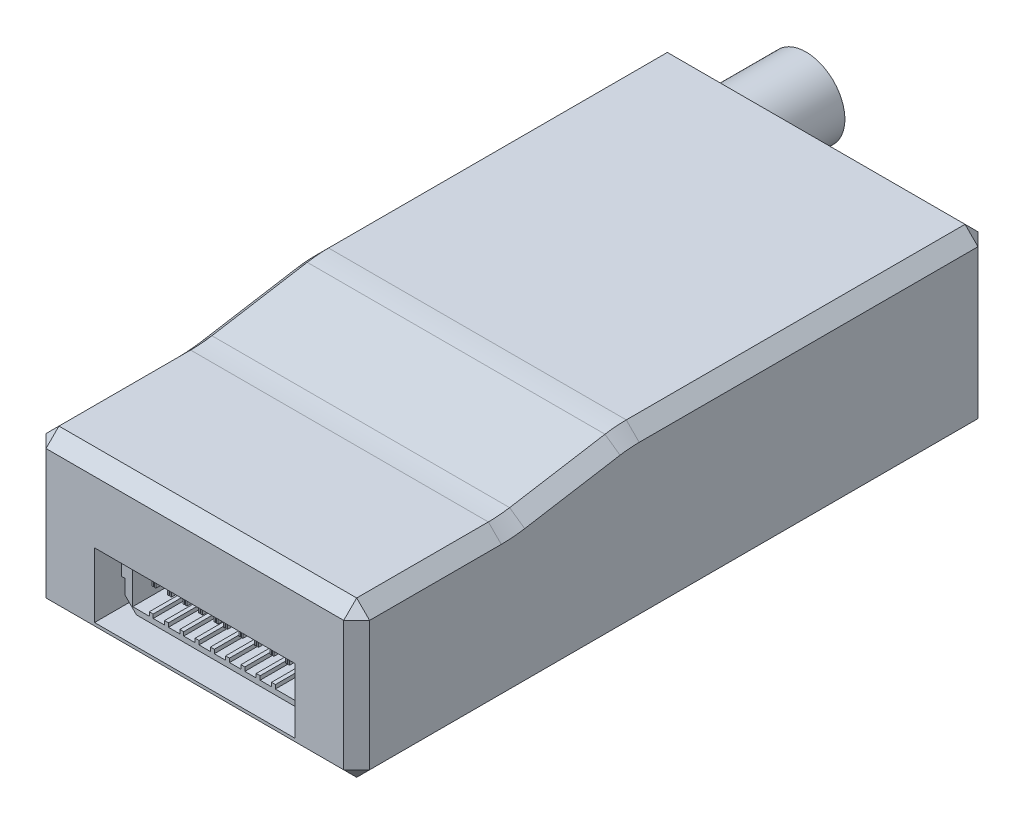
from build123d import *

# Parameters (mm, degrees)
BOSS_EXTRUDE1_DEPTH = 25
CHAMFER1_SIZE       = 1
SKETCH4_W           = 15.5
SKETCH4_H           = 5
CUT_EXTRUDE1_DEPTH  = 10
SKETCH5_W           = 1
SKETCH5_H           = 0.55
BOSS_EXTRUDE2_DEPTH = 8
CUT_EXTRUDE2_DEPTH  = 10
SKETCH7_W           = 0.3
SKETCH7_H           = 0.3
BOSS_EXTRUDE3_DEPTH = 10
SKETCH8_R           = 3
SKETCH8_R_2         = 2.5
BOSS_EXTRUDE4_DEPTH = 6


with BuildPart() as part:
    # Sketch3 → Boss-Extrude1 (new body)
    with BuildSketch(Plane(origin=(0, 0, 0), x_dir=(0, 0, -1), z_dir=(1, 0, 0))):
        with BuildLine():
            Line((0, 0), (-49, 0))
            Line((-49, 0), (-49, 12))
            Line((-49, 12), (-37.827625303, 12))
            ThreePointArc((-37.827625303, 12), (-37.002819988, 12.03407324), (-36.18363543, 12.136060762))
            Line((-36.18363543, 12.136060762), (-28.81636457, 13.363939238))
            ThreePointArc((-28.81636457, 13.363939238), (-27.997180012, 13.46592676), (-27.172374697, 13.5))
            Line((-27.172374697, 13.5), (0, 13.5))
            Line((0, 13.5), (0, 0))
        make_face()
    extrude(amount=BOSS_EXTRUDE1_DEPTH)

    # Chamfer1
    chamfer1_edges = [part.edges().sort_by_distance(p)[0] for p in [
        (0, 12.75, 32.5),
        (0, 13.46592676, 27.997180012),
        (0, 13.5, 13.586187349),
        (0, 6.75, 0),
        (25, 13.46592676, 27.997180012),
        (12.5, 0, 0),
        (12.5, 0, 49),
        (12.5, 12, 49),
        (12.5, 13.5, 0),
        (25, 12.75, 32.5),
        (25, 12.03407324, 37.002819988),
        (25, 12, 43.413812651),
        (25, 6, 49),
        (25, 0, 24.5),
        (25, 6.75, 0),
        (0, 0, 24.5),
        (25, 13.5, 13.586187349),
        (0, 6, 49),
        (0, 12, 43.413812651),
        (0, 12.03407324, 37.002819988),
    ]]
    chamfer(chamfer1_edges, length=CHAMFER1_SIZE)

    # Sketch4 → Cut-Extrude1 (cut)
    with BuildSketch(Plane.XY.offset(49)):
        with Locations((12.5, 3.731572294)):
            Rectangle(SKETCH4_W, SKETCH4_H)
    extrude(amount=-CUT_EXTRUDE1_DEPTH, mode=Mode.SUBTRACT)

    # Sketch5 → Boss-Extrude2 (add)
    with BuildSketch(Plane.XY.offset(39)):
        Polygon((20.186366737, 6.162059048), (4.813633263, 6.162059048), (4.813633263, 3.362059048), (5.1, 3.362059048), (5.1, 2.250733439), (5.988674392, 1.362059048), (19.011325608, 1.362059048), (19.9, 2.250733439), (19.9, 3.362059048), (20.186366737, 3.362059048), align=None)
        Polygon((8.1, 6.062059048), (16.9, 6.062059048), (16.9, 4.562059048), (15.516884386, 4.562059048), (15.030478648, 4.762059048), (9.969521352, 4.762059048), (9.483115614, 4.562059048), (8.1, 4.562059048), align=None, mode=Mode.SUBTRACT)
        with Locations((17.75, 5.405243542)):
            Rectangle(SKETCH5_W, SKETCH5_H, mode=Mode.SUBTRACT)
        with Locations((19.15, 5.399458355)):
            Rectangle(SKETCH5_W, SKETCH5_H, mode=Mode.SUBTRACT)
        with Locations((5.85, 5.399458355)):
            Rectangle(SKETCH5_W, SKETCH5_H, mode=Mode.SUBTRACT)
        with Locations((7.25, 5.405243542)):
            Rectangle(SKETCH5_W, SKETCH5_H, mode=Mode.SUBTRACT)
    extrude(amount=BOSS_EXTRUDE2_DEPTH)

    # Sketch6 → Cut-Extrude2 (cut)
    with BuildSketch(Plane.XY.offset(47)):
        Polygon((12.29, 4.267126877), (12.71, 4.267126877), (12.71, 3.897126877), (12.81, 3.897126877), (12.81, 4.267126877), (12.91, 4.267126877), (12.91, 3.897644042), (13.01, 3.897644042), (13.01, 4.267126877), (13.91, 4.267126877), (13.91, 3.897126877), (14.01, 3.897126877), (14.01, 4.267126877), (14.11, 4.267126877), (14.11, 3.897644042), (14.21, 3.897644042), (14.21, 4.267126877), (15.11, 4.267126877), (15.11, 3.897126877), (15.21, 3.897126877), (15.21, 4.267126877), (15.31, 4.267126877), (15.31, 3.897644042), (15.41, 3.897644042), (15.41, 4.267126877), (16.31, 4.267126877), (16.31, 3.897126877), (16.41, 3.897126877), (16.41, 4.267126877), (16.51, 4.267126877), (16.51, 3.897644042), (16.61, 3.897644042), (16.61, 4.267126877), (17.51, 4.267126877), (17.51, 3.897126877), (17.61, 3.897126877), (17.61, 4.267126877), (17.71, 4.267126877), (17.71, 3.897644042), (17.81, 3.897644042), (17.81, 4.267126877), (18.18, 4.267126877), (18.18, 4.477126877), (18.4, 4.477126877), (18.4, 4.267126877), (18.9, 4.267126877), (18.9, 4.767126877), (19.3, 4.767126877), (19.3, 1.767126877), (5.7, 1.767126877), (5.7, 4.767126877), (6.1, 4.767126877), (6.1, 4.267126877), (6.6, 4.267126877), (6.6, 4.477126877), (6.82, 4.477126877), (6.82, 4.267126877), (7.19, 4.267126877), (7.19, 3.897644042), (7.29, 3.897644042), (7.29, 4.267126877), (7.39, 4.267126877), (7.39, 3.897126877), (7.49, 3.897126877), (7.49, 4.267126877), (8.39, 4.267126877), (8.39, 3.897644042), (8.49, 3.897644042), (8.49, 4.267126877), (8.59, 4.267126877), (8.59, 3.897126877), (8.69, 3.897126877), (8.69, 4.267126877), (9.59, 4.267126877), (9.59, 3.897644042), (9.69, 3.897644042), (9.69, 4.267126877), (9.79, 4.267126877), (9.79, 3.897126877), (9.89, 3.897126877), (9.89, 4.267126877), (10.79, 4.267126877), (10.79, 3.897644042), (10.89, 3.897644042), (10.89, 4.267126877), (10.99, 4.267126877), (10.99, 3.897126877), (11.09, 3.897126877), (11.09, 4.267126877), (11.99, 4.267126877), (11.99, 3.897644042), (12.09, 3.897644042), (12.09, 4.267126877), (12.19, 4.267126877), (12.19, 3.897126877), (12.29, 3.897126877), align=None)
    extrude(amount=-CUT_EXTRUDE2_DEPTH, mode=Mode.SUBTRACT)

    # Sketch7 → Boss-Extrude3 (add)
    with BuildSketch(Plane.XY.offset(47)):
        with Locations((7.13, 1.917126877)):
            Rectangle(SKETCH7_W, SKETCH7_H)
        with Locations((8.31, 1.917126877)):
            Rectangle(SKETCH7_W, SKETCH7_H)
        with Locations((9.49, 1.917126877)):
            Rectangle(SKETCH7_W, SKETCH7_H)
        with Locations((10.67, 1.917126877)):
            Rectangle(SKETCH7_W, SKETCH7_H)
        with Locations((11.85, 1.917126877)):
            Rectangle(SKETCH7_W, SKETCH7_H)
        with Locations((13.03, 1.917126877)):
            Rectangle(SKETCH7_W, SKETCH7_H)
        with Locations((14.21, 1.917126877)):
            Rectangle(SKETCH7_W, SKETCH7_H)
        with Locations((15.39, 1.917126877)):
            Rectangle(SKETCH7_W, SKETCH7_H)
        with Locations((16.57, 1.917126877)):
            Rectangle(SKETCH7_W, SKETCH7_H)
    extrude(amount=-BOSS_EXTRUDE3_DEPTH)

    # Sketch8 → Boss-Extrude4 (add)
    with BuildSketch(Plane(origin=(0, 0, 0), x_dir=(-1, 0, 0), z_dir=(0, 0, -1))):
        with Locations((-4.714743405, 8.886764937)):
            Circle(SKETCH8_R)
        with Locations((-4.714743405, 8.886764937)):
            Circle(SKETCH8_R_2, mode=Mode.SUBTRACT)
    extrude(amount=BOSS_EXTRUDE4_DEPTH)


solid = part.part
